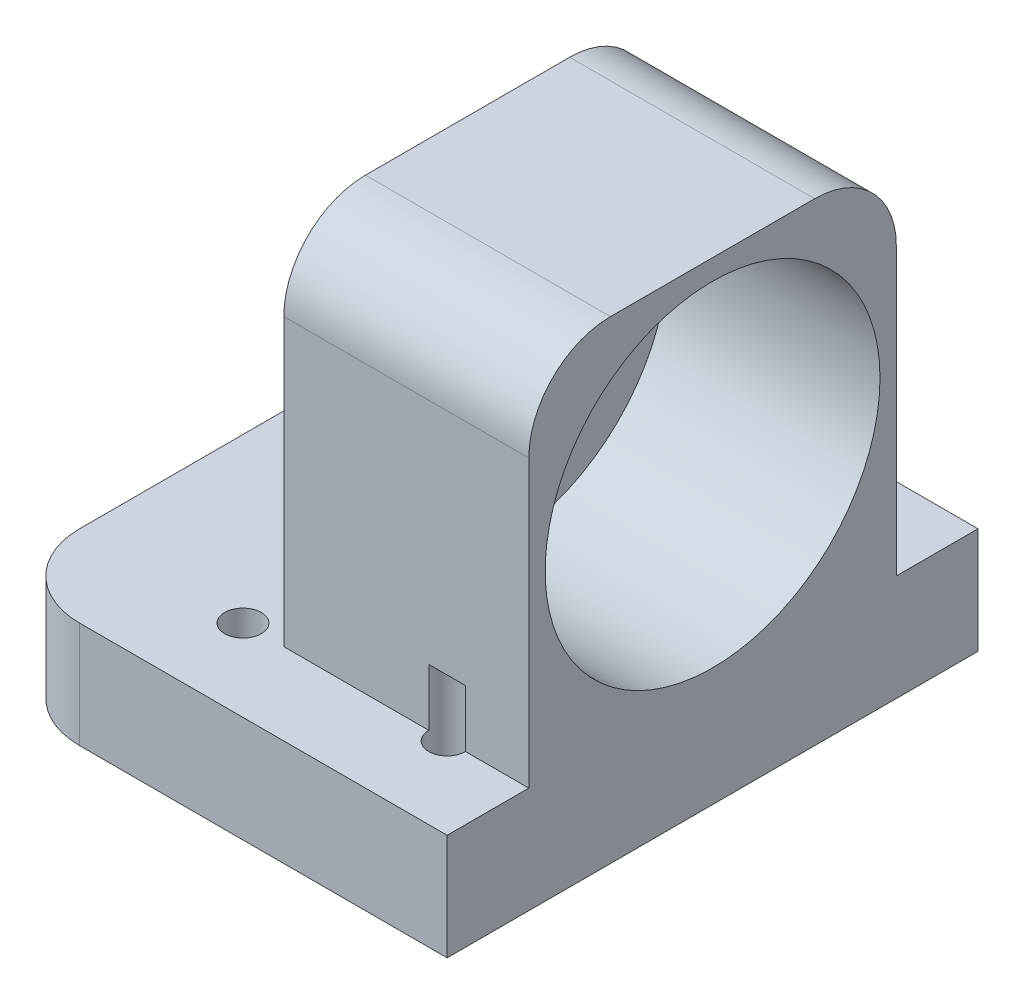
from build123d import *

# Parameters (mm, degrees)
SKETCH1_W           = 55
SKETCH1_H           = 65
BOSS_EXTRUDE1_DEPTH = 13
SKETCH2_W           = 30
SKETCH2_H           = 45
BOSS_EXTRUDE2_DEPTH = 50
SKETCH5_R           = 20.5
CUT_EXTRUDE1_DEPTH  = 26
SKETCH7_R           = 7
CUT_EXTRUDE2_DEPTH  = 20
SKETCH8_R           = 2.25
CUT_EXTRUDE3_DEPTH  = 20
FILLET2_R           = 10
SKETCH9_W           = 30
SKETCH9_H           = 45
CUT_EXTRUDE4_DEPTH  = 5
FILLET3_R           = 10
FILLET4_R           = 10


with BuildPart() as part:
    # Sketch1 → Boss-Extrude1 (new body)
    with BuildSketch(Plane(origin=(0, 0, 0), x_dir=(1, 0, 0), z_dir=(0, 1, 0))):
        with Locations((-5, 0)):
            Rectangle(SKETCH1_W, SKETCH1_H)
    extrude(amount=BOSS_EXTRUDE1_DEPTH)

    # Sketch2 → Boss-Extrude2 (add)
    with BuildSketch(Plane(origin=(0, 13, 0), x_dir=(1, 0, 0), z_dir=(0, 1, 0))):
        with Locations((7.5, 0)):
            Rectangle(SKETCH2_W, SKETCH2_H)
    extrude(amount=BOSS_EXTRUDE2_DEPTH)

    # Sketch5 → Cut-Extrude1 (cut)
    with BuildSketch(Plane(origin=(22.5, 0, 0), x_dir=(0, 0, -1), z_dir=(1, 0, 0))):
        with Locations((0, 35)):
            Circle(SKETCH5_R)
    extrude(amount=-CUT_EXTRUDE1_DEPTH, mode=Mode.SUBTRACT)

    # Sketch7 → Cut-Extrude2 (cut)
    with BuildSketch(Plane(origin=(-3.5, 0, 0), x_dir=(0, 0, -1), z_dir=(1, 0, 0))):
        with Locations((0, 35)):
            Circle(SKETCH7_R)
    extrude(amount=-CUT_EXTRUDE2_DEPTH, mode=Mode.SUBTRACT)

    # Sketch8 → Cut-Extrude3 (cut)
    with BuildSketch(Plane(origin=(0, 0, 0), x_dir=(-1, 0, 0), z_dir=(0, -1, 0))):
        with Locations(Location((12.5, -22.5, 0), (0, 0, 90))):
            Circle(SKETCH8_R)
        with Locations(Location((12.5, 22.5, 0), (0, 0, 90))):
            Circle(SKETCH8_R)
        with Locations(Location((-12.5, 22.5, 0), (0, 0, 90))):
            Circle(SKETCH8_R)
        with Locations(Location((-12.5, -22.5, 0), (0, 0, 90))):
            Circle(SKETCH8_R)
    extrude(amount=-CUT_EXTRUDE3_DEPTH, mode=Mode.SUBTRACT)

    # Fillet2
    fillet2_edges = [part.edges().sort_by_distance(p)[0] for p in [
        (-32.5, 6.5, 32.5),
    ]]
    fillet(fillet2_edges, radius=FILLET2_R)

    # Sketch9 → Cut-Extrude4 (cut)
    with BuildSketch(Plane(origin=(0, 63, 0), x_dir=(1, 0, 0), z_dir=(0, 1, 0))):
        with Locations((7.5, 0)):
            Rectangle(SKETCH9_W, SKETCH9_H)
    extrude(amount=-CUT_EXTRUDE4_DEPTH, mode=Mode.SUBTRACT)

    # Fillet3
    fillet3_edges = [part.edges().sort_by_distance(p)[0] for p in [
        (7.5, 58, 22.5),
    ]]
    fillet(fillet3_edges, radius=FILLET3_R)

    # Fillet4
    fillet4_edges = [part.edges().sort_by_distance(p)[0] for p in [
        (7.5, 58, -22.5),
    ]]
    fillet(fillet4_edges, radius=FILLET4_R)


solid = part.part
